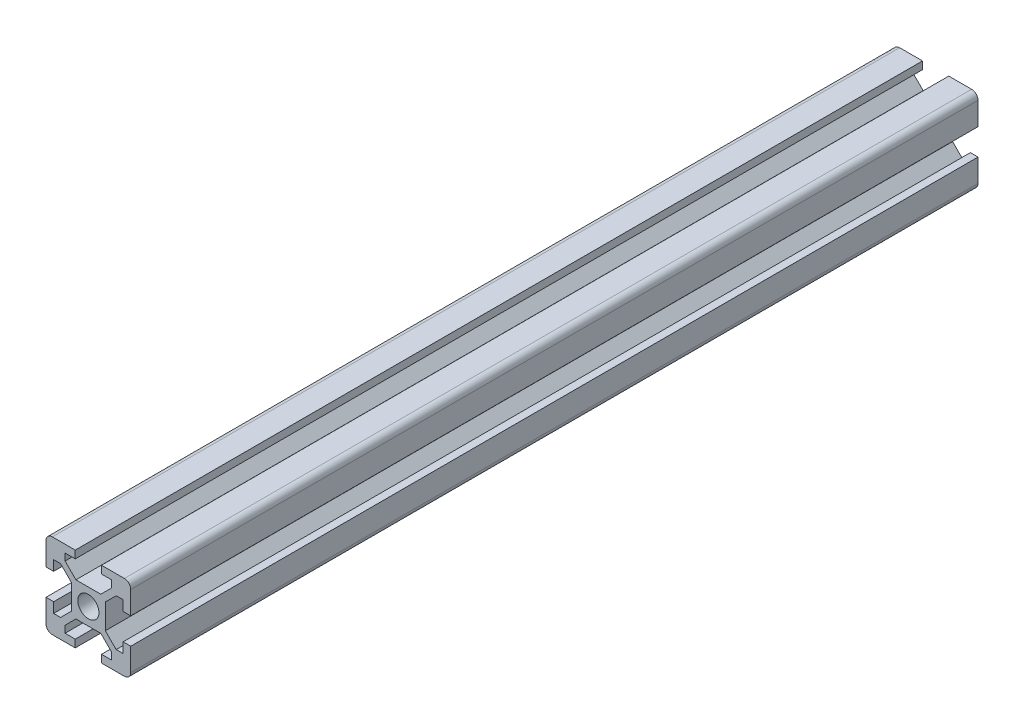
from build123d import *

# Parameters (mm, degrees)
SKETCH_1_R      = 2.5
EXTRUDE_2_DEPTH = 200


with BuildPart() as part:
    # 草图1 → 凸台-拉伸2 (new body)
    with BuildSketch(Plane.XY):
        with BuildLine():
            Line((5.5, -8.2), (5.5, -6.560660172))
            Line((5.5, -6.560660172), (2.939339828, -4))
            Line((2.939339828, -4), (-2.939339828, -4))
            Line((-2.939339828, -4), (-5.5, -6.560660172))
            Line((-5.5, -6.560660172), (-5.5, -8.2))
            Line((-5.5, -8.2), (-3.1, -8.2))
            Line((-3.1, -8.2), (-3.1, -10))
            Line((-3.1, -10), (-8.5, -10))
            ThreePointArc((-8.5, -10), (-9.560660172, -9.560660172), (-10, -8.5))
            Line((-10, -8.5), (-10, -3.1))
            Line((-10, -3.1), (-8.2, -3.1))
            Line((-8.2, -3.1), (-8.2, -5.5))
            Line((-8.2, -5.5), (-6.560660172, -5.5))
            Line((-6.560660172, -5.5), (-4, -2.939339828))
            Line((-4, -2.939339828), (-4, 2.939339828))
            Line((-4, 2.939339828), (-6.560660172, 5.5))
            Line((-6.560660172, 5.5), (-8.2, 5.5))
            Line((-8.2, 5.5), (-8.2, 3.1))
            Line((-8.2, 3.1), (-10, 3.1))
            Line((-10, 3.1), (-10, 8.5))
            ThreePointArc((-10, 8.5), (-9.560660172, 9.560660172), (-8.5, 10))
            Line((-8.5, 10), (-3.1, 10))
            Line((-3.1, 10), (-3.1, 8.2))
            Line((-3.1, 8.2), (-5.5, 8.2))
            Line((-5.5, 8.2), (-5.5, 6.560660172))
            Line((-5.5, 6.560660172), (-2.939339828, 4))
            Line((-2.939339828, 4), (2.939339828, 4))
            Line((2.939339828, 4), (5.5, 6.560660172))
            Line((5.5, 6.560660172), (5.5, 8.2))
            Line((5.5, 8.2), (3.1, 8.2))
            Line((3.1, 8.2), (3.1, 10))
            Line((3.1, 10), (8.5, 10))
            ThreePointArc((8.5, 10), (9.560660172, 9.560660172), (10, 8.5))
            Line((10, 8.5), (10, 3.1))
            Line((10, 3.1), (8.2, 3.1))
            Line((8.2, 3.1), (8.2, 5.5))
            Line((8.2, 5.5), (6.560660172, 5.5))
            Line((6.560660172, 5.5), (4, 2.939339828))
            Line((4, 2.939339828), (4, -2.939339828))
            Line((4, -2.939339828), (6.560660172, -5.5))
            Line((6.560660172, -5.5), (8.2, -5.5))
            Line((8.2, -5.5), (8.2, -3.1))
            Line((8.2, -3.1), (10, -3.1))
            Line((10, -3.1), (10, -8.5))
            ThreePointArc((10, -8.5), (9.560660172, -9.560660172), (8.5, -10))
            Line((8.5, -10), (3.1, -10))
            Line((3.1, -10), (3.1, -8.2))
            Line((3.1, -8.2), (5.5, -8.2))
        make_face()
        Circle(SKETCH_1_R, mode=Mode.SUBTRACT)
    extrude(amount=-EXTRUDE_2_DEPTH)


solid = part.part
